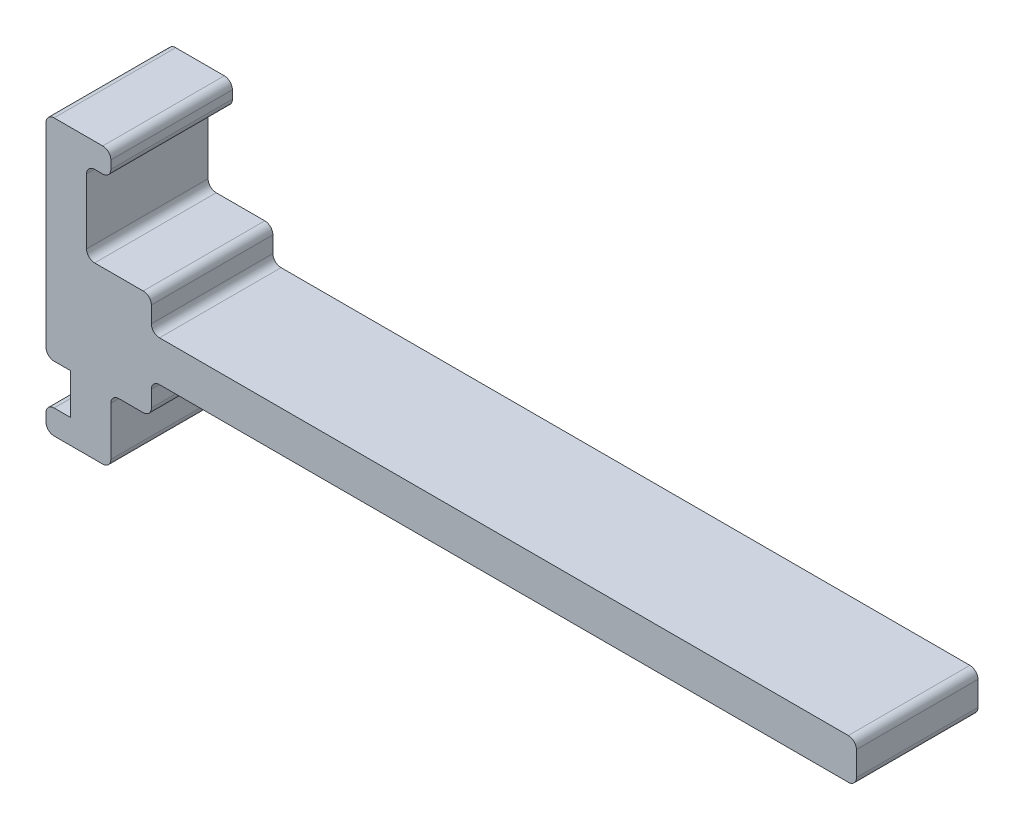
from build123d import *

# Parameters (mm, degrees)
BOSS_EXTRUDE1_DEPTH = 7.5


with BuildPart() as part:
    # Sketch1 → Boss-Extrude1 (new, symmetric)
    with BuildSketch(Plane.XY):
        with BuildLine():
            Line((-50, 2.5), (-50, 18.5))
            ThreePointArc((-50, 18.5), (-49.707106781, 19.207106781), (-49, 19.5))
            Line((-49, 19.5), (-45, 19.5))
            Line((-45, 19.5), (-43, 19.5))
            ThreePointArc((-43, 19.5), (-42.292893219, 19.207106781), (-42, 18.5))
            Line((-42, 18.5), (-42, 17.5))
            ThreePointArc((-42, 17.5), (-42.292893219, 16.792893219), (-43, 16.5))
            Line((-43, 16.5), (-44, 16.5))
            ThreePointArc((-44, 16.5), (-44.707106781, 16.207106781), (-45, 15.5))
            Line((-45, 15.5), (-45, 7.5))
            ThreePointArc((-45, 7.5), (-44.707106781, 6.792893219), (-44, 6.5))
            Line((-44, 6.5), (-38, 6.5))
            ThreePointArc((-38, 6.5), (-37.292893219, 6.207106781), (-37, 5.5))
            Line((-37, 5.5), (-37, 3.5))
            ThreePointArc((-37, 3.5), (-36.707106781, 2.792893219), (-36, 2.5))
            Line((-36, 2.5), (49, 2.5))
            ThreePointArc((49, 2.5), (49.707106781, 2.207106781), (50, 1.5))
            Line((50, 1.5), (50, -1.5))
            ThreePointArc((50, -1.5), (49.707106781, -2.207106781), (49, -2.5))
            Line((49, -2.5), (-36, -2.5))
            ThreePointArc((-36, -2.5), (-36.707106781, -2.792893219), (-37, -3.5))
            Line((-37, -3.5), (-37, -5.5))
            ThreePointArc((-37, -5.5), (-37.292893219, -6.207106781), (-38, -6.5))
            Line((-38, -6.5), (-41, -6.5))
            ThreePointArc((-41, -6.5), (-41.707106781, -6.792893219), (-42, -7.5))
            Line((-42, -7.5), (-42, -13.5))
            ThreePointArc((-42, -13.5), (-42.292893219, -14.207106781), (-43, -14.5))
            Line((-43, -14.5), (-49, -14.5))
            ThreePointArc((-49, -14.5), (-49.707106781, -14.207106781), (-50, -13.5))
            Line((-50, -13.5), (-50, -12.5))
            ThreePointArc((-50, -12.5), (-49.707106781, -11.792893219), (-49, -11.5))
            Line((-49, -11.5), (-47, -11.5))
            Line((-47, -11.5), (-47, -6.5))
            Line((-47, -6.5), (-49, -6.5))
            ThreePointArc((-49, -6.5), (-49.707106781, -6.207106781), (-50, -5.5))
            Line((-50, -5.5), (-50, -2.5))
            Line((-50, -2.5), (-50, 2.5))
        make_face()
    extrude(amount=BOSS_EXTRUDE1_DEPTH, both=True)


solid = part.part
